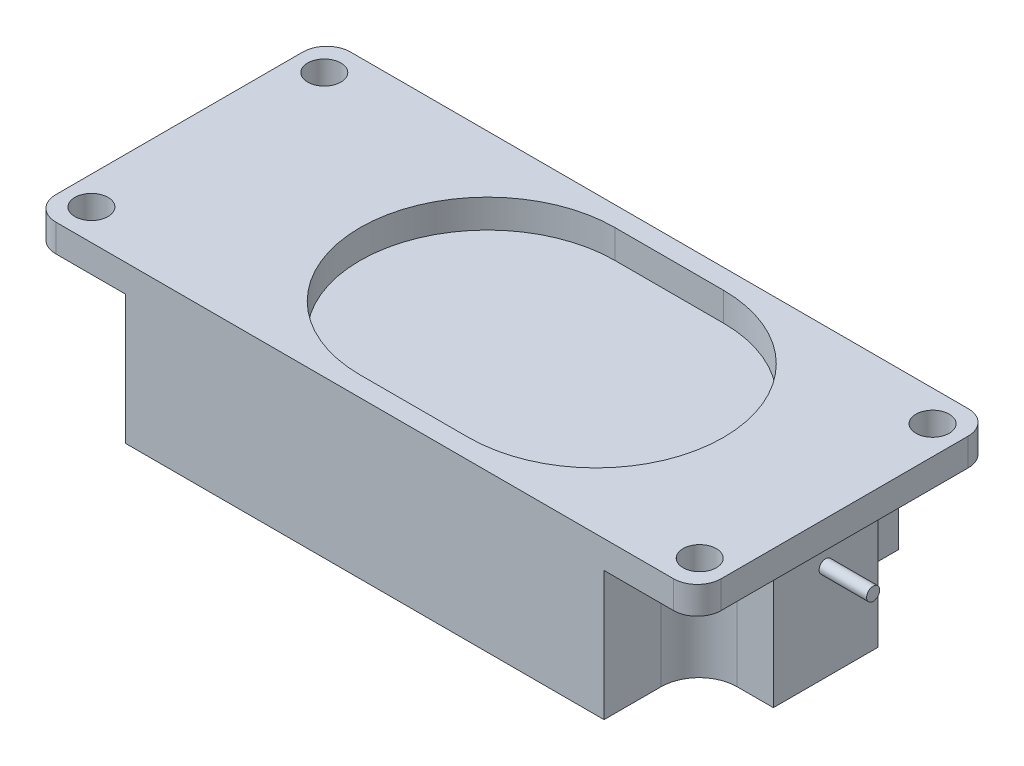
from build123d import *

# Parameters (mm, degrees)
SKETCH1_W           = 70
SKETCH1_H           = 31
SKETCH1_R           = 1.75
BOSS_EXTRUDE1_DEPTH = 2.9
FILLET1_R           = 2.5
BOSS_EXTRUDE2_DEPTH = 13.6
FILLET2_R           = 4
CUT_EXTRUDE1_DEPTH  = 3
SKETCH4_R           = 0.691032606
BOSS_EXTRUDE3_DEPTH = 5


with BuildPart() as part:
    # Sketch1 → Boss-Extrude1 (new body)
    with BuildSketch(Plane(origin=(0, 0, 0), x_dir=(1, 0, 0), z_dir=(0, 1, 0))):
        Rectangle(SKETCH1_W, SKETCH1_H)
        with Locations(Location((-32, 12.25, 0), (0, 0, 270))):
            Circle(SKETCH1_R, mode=Mode.SUBTRACT)
        with Locations(Location((-32, -12.25, 0), (0, 0, 270))):
            Circle(SKETCH1_R, mode=Mode.SUBTRACT)
        with Locations(Location((32, -12.25, 0), (0, 0, 270))):
            Circle(SKETCH1_R, mode=Mode.SUBTRACT)
        with Locations(Location((32, 12.25, 0), (0, 0, 270))):
            Circle(SKETCH1_R, mode=Mode.SUBTRACT)
    extrude(amount=BOSS_EXTRUDE1_DEPTH)

    # Fillet1
    fillet1_edges = [part.edges().sort_by_distance(p)[0] for p in [
        (-35, 1.45, -15.5),
        (35, 1.45, -15.5),
        (35, 1.45, 15.5),
        (-35, 1.45, 15.5),
    ]]
    fillet(fillet1_edges, radius=FILLET1_R)

    # Sketch2 → Boss-Extrude2 (add)
    with BuildSketch(Plane.XZ):
        Polygon((-25.185, -15.5), (25.185, -15.5), (25.185, -5.5), (33, -5.5), (33, 5.5), (25.185, 5.5), (25.185, 15.5), (-25.185, 15.5), (-25.185, 5.5), (-33, 5.5), (-33, -5.5), (-25.185, -5.5), align=None)
    extrude(amount=BOSS_EXTRUDE2_DEPTH)

    # Fillet2
    fillet2_edges = [part.edges().sort_by_distance(p)[0] for p in [
        (25.185, -6.8, 5.5),
        (-25.185, -6.8, 5.5),
        (-25.185, -6.8, -5.5),
        (25.185, -6.8, -5.5),
    ]]
    fillet(fillet2_edges, radius=FILLET2_R)

    # Sketch3 → Cut-Extrude1 (cut)
    with BuildSketch(Plane(origin=(0, 2.9, 0), x_dir=(1, 0, 0), z_dir=(0, 1, 0))):
        with BuildLine():
            Line((-2.575, 13.415), (8.835, 13.415))
            ThreePointArc((8.835, 13.415), (22.25, 0), (8.835, -13.415))
            Line((8.835, -13.415), (-2.575, -13.415))
            ThreePointArc((-2.575, -13.415), (-15.99, 0), (-2.575, 13.415))
        make_face()
    extrude(amount=-CUT_EXTRUDE1_DEPTH, mode=Mode.SUBTRACT)

    # Sketch4 → Boss-Extrude3 (add)
    with BuildSketch(Plane(origin=(33, 0, 0), x_dir=(0, 0, -1), z_dir=(1, 0, 0))):
        with Locations(Location((0, -3.46433499, 0), (0, 0, 180))):
            Circle(SKETCH4_R)
    extrude(amount=BOSS_EXTRUDE3_DEPTH)


solid = part.part
